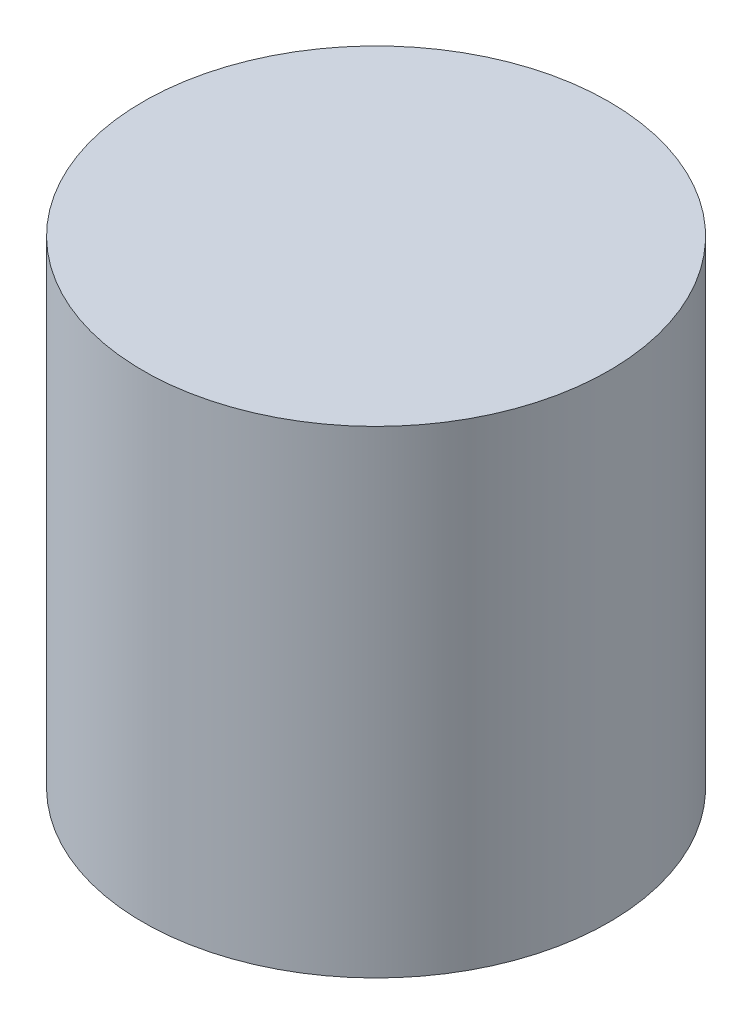
from build123d import *

# Parameters (mm, degrees)
SKETCH1_R           = 200
BOSS_EXTRUDE1_DEPTH = 410


with BuildPart() as part:
    # Sketch1 → Boss-Extrude1 (new body)
    with BuildSketch(Plane(origin=(0, 0, 0), x_dir=(1, 0, 0), z_dir=(0, 1, 0))):
        with Locations(Location((0, 0, 0), (0, 0, 90))):
            Circle(SKETCH1_R)
    extrude(amount=BOSS_EXTRUDE1_DEPTH)


solid = part.part
